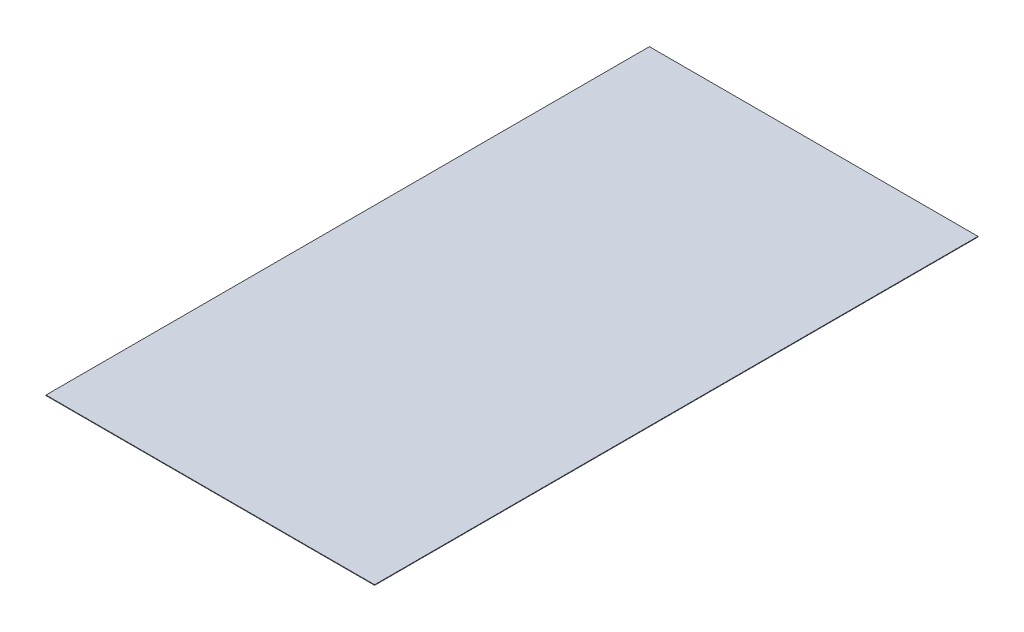
from build123d import *

# Parameters (mm, degrees)
SKETCH1_W           = 598
SKETCH1_H           = 1098
BOSS_EXTRUDE1_DEPTH = 1


with BuildPart() as part:
    # Sketch1 → Boss-Extrude1 (new body)
    with BuildSketch(Plane(origin=(0, 0, 0), x_dir=(1, 0, 0), z_dir=(0, 1, 0))):
        with Locations((-224.214843428, -493.141854837)):
            Rectangle(SKETCH1_W, SKETCH1_H)
    extrude(amount=BOSS_EXTRUDE1_DEPTH)


solid = part.part
